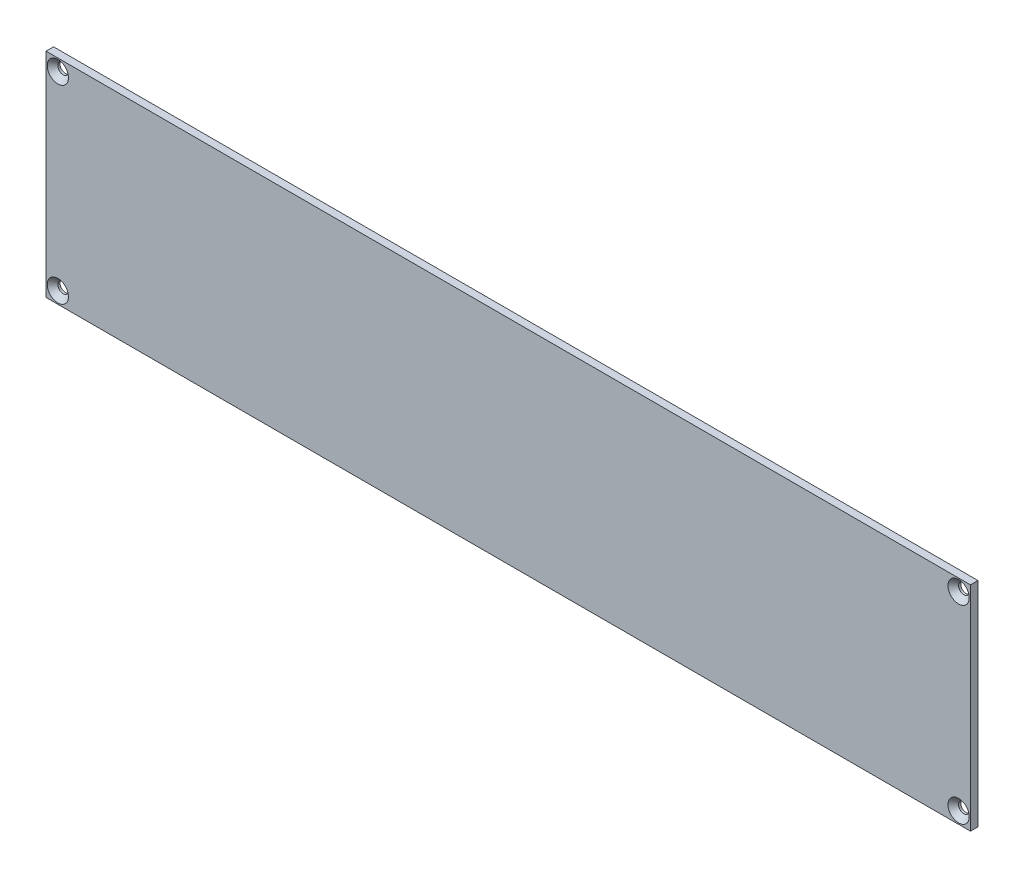
from build123d import *

# Parameters (mm, degrees)
SKETCH1_W                    = 390
SKETCH1_H                    = 90
BOSS_EXTRUDE1_DEPTH          = 3.175
CSK_FOR_M4_SFHCS1_AT_2_COUNT = 2
CSK_FOR_M4_SFHCS1_AT_2_PITCH = 388.329756779
CSK_FOR_M4_SFHCS1_AT_3_COUNT = 2
CSK_FOR_M4_SFHCS1_AT_3_PITCH = 380
CSK_FOR_M4_SFHCS1_AT_4_COUNT = 2
CSK_FOR_M4_SFHCS1_AT_4_PITCH = 80


with BuildPart() as part:
    # Sketch1 → Boss-Extrude1 (new body)
    with BuildSketch(Plane.XY):
        Rectangle(SKETCH1_W, SKETCH1_H)
    extrude(amount=BOSS_EXTRUDE1_DEPTH)

    # Sketch3 → CSK for M4 SFHCS1 (revolve, cut)
    with BuildSketch(Plane(origin=(190, 40, 3.175), x_dir=(0, -1, 0), z_dir=(1, 0, 0))):
        Polygon((0, 0), (0, 3.175), (2.25, 3.175), (2.25, 2.23), (4.48, 0), align=None)
    csk_for_m4_sfhcs1 = revolve(axis=Axis((190, 40, 9.525), (0, 0, -1)), mode=Mode.SUBTRACT)

    # CSK for M4 SFHCS1 at 2: CSK for M4 SFHCS1 ×2
    with Locations(*[Vector(-0.9785497849867489, -0.20601048104984204, 0) * (i * CSK_FOR_M4_SFHCS1_AT_2_PITCH) for i in range(1, CSK_FOR_M4_SFHCS1_AT_2_COUNT)]):
        add(csk_for_m4_sfhcs1, mode=Mode.SUBTRACT)

    # CSK for M4 SFHCS1 at 3: CSK for M4 SFHCS1 ×2
    with Locations(*[(-i * CSK_FOR_M4_SFHCS1_AT_3_PITCH, 0, 0) for i in range(1, CSK_FOR_M4_SFHCS1_AT_3_COUNT)]):
        add(csk_for_m4_sfhcs1, mode=Mode.SUBTRACT)

    # CSK for M4 SFHCS1 at 4: CSK for M4 SFHCS1 ×2
    with Locations(*[(0, -i * CSK_FOR_M4_SFHCS1_AT_4_PITCH, 0) for i in range(1, CSK_FOR_M4_SFHCS1_AT_4_COUNT)]):
        add(csk_for_m4_sfhcs1, mode=Mode.SUBTRACT)


solid = part.part
